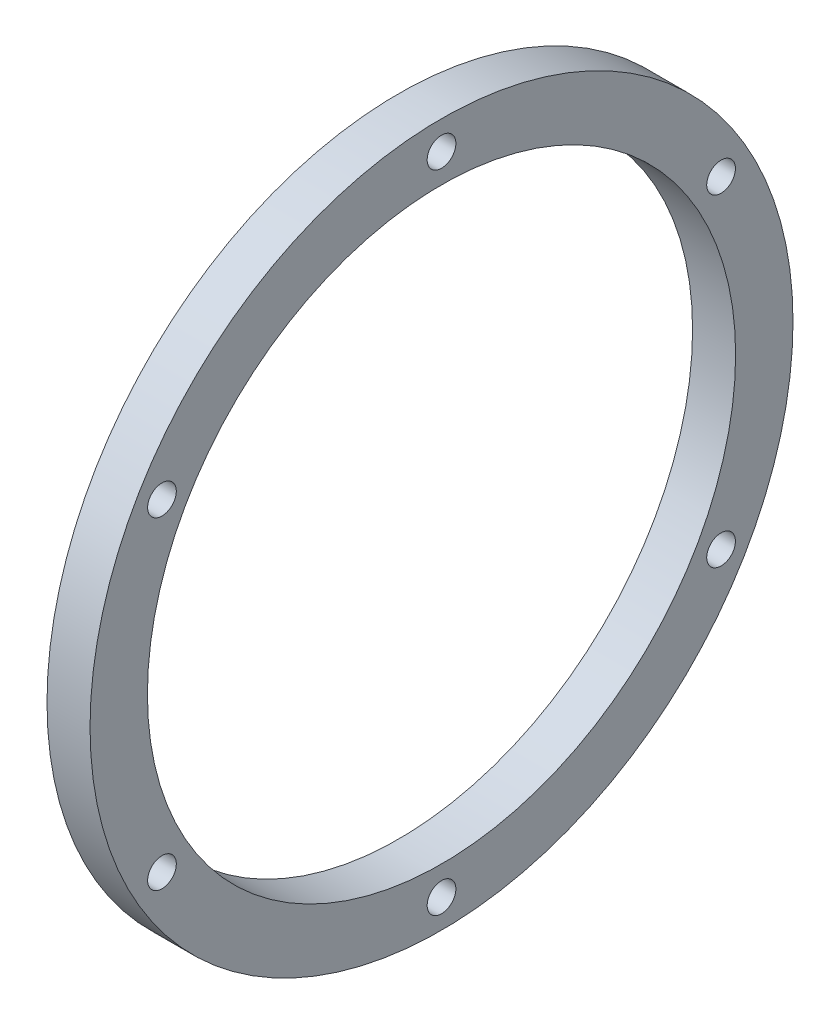
from build123d import *

# Parameters (mm, degrees)
SKETCH1_R           = 49
SKETCH1_R_2         = 41
BOSS_EXTRUDE1_DEPTH = 6
CIRPATTERN1_COUNT   = 6


with BuildPart() as part:
    # Sketch1 → Boss-Extrude1 (new body)
    with BuildSketch(Plane(origin=(0, 0, 0), x_dir=(0, 0, -1), z_dir=(1, 0, 0))):
        Circle(SKETCH1_R)
        Circle(SKETCH1_R_2, mode=Mode.SUBTRACT)
    extrude(amount=BOSS_EXTRUDE1_DEPTH)

    # Sketch3 → Ø4.0mm Dowel Hole1 (revolve, cut)
    with BuildSketch(Plane(origin=(6, 45, 0), x_dir=(0, 0, -1), z_dir=(0, 1, 0))):
        Polygon((0, 0), (0, 51.201721238), (2, 50), (2, 0), align=None)
    f_4_0mm_dowel_hole1 = revolve(axis=Axis((12.35, 45, 0), (-1, 0, 0)), mode=Mode.SUBTRACT)

    # CirPattern1: Ø4.0mm Dowel Hole1 ×6 about axis
    cirpattern1_axis = Axis((0, 0, 0), (1, 0, 0))
    for i in range(1, CIRPATTERN1_COUNT):
        add(f_4_0mm_dowel_hole1.rotate(cirpattern1_axis, i * 360 / CIRPATTERN1_COUNT), mode=Mode.SUBTRACT)


solid = part.part
